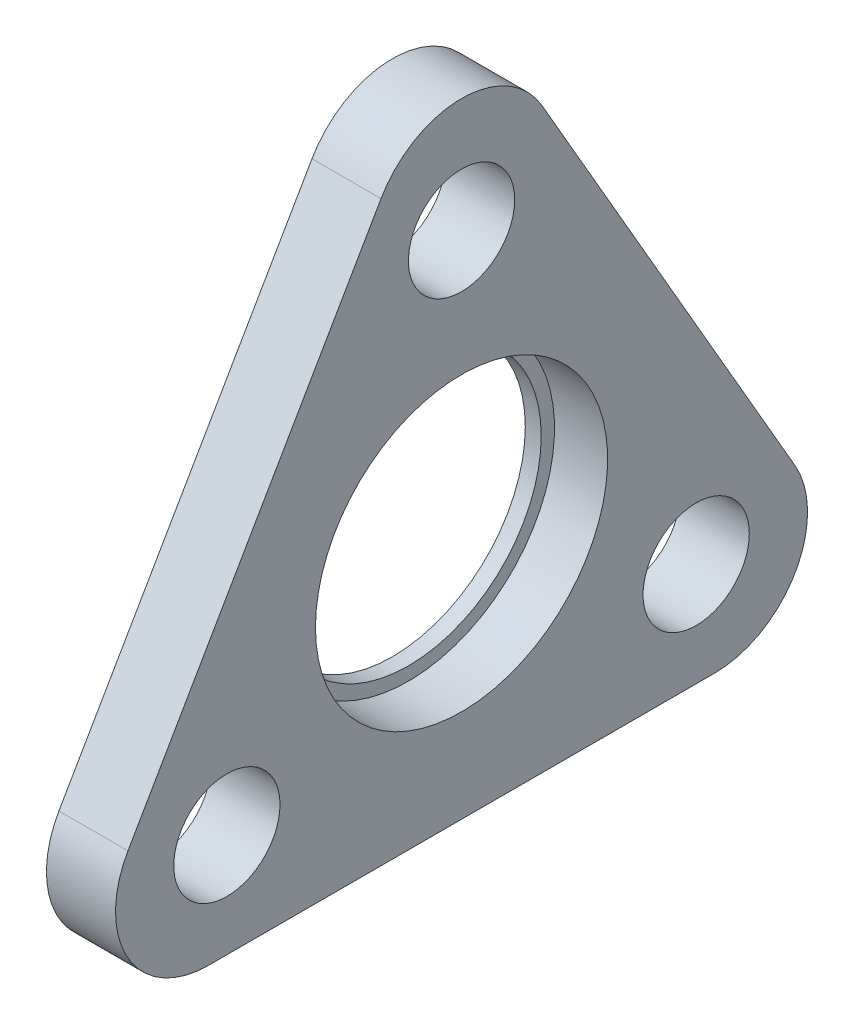
from build123d import *

# Parameters (mm, degrees)
SKETCH_1_R          = 2
EXTRUDE_2_DEPTH     = 2.6
FILLET_1_R          = 3.5
SKETCH_4_R          = 5.5
CUT_EXTRUDE_1_DEPTH = 20.664535491
SKETCH_6_R          = 5.5
SKETCH_6_R_2        = 5
EXTRUDE_4_DEPTH     = 0.6


with BuildPart() as part:
    # 草图1 → 凸台-拉伸2 (new body)
    with BuildSketch(Plane(origin=(0, 0, 0), x_dir=(0, 0, -1), z_dir=(1, 0, 0))):
        Polygon((0, 18), (-15.588457268, -9), (15.588457268, -9), align=None)
        with Locations((0, 10.2)):
            Circle(SKETCH_1_R, mode=Mode.SUBTRACT)
        with Locations((8.833459119, -5.1)):
            Circle(SKETCH_1_R, mode=Mode.SUBTRACT)
        with Locations((-8.833459119, -5.1)):
            Circle(SKETCH_1_R, mode=Mode.SUBTRACT)
    extrude(amount=EXTRUDE_2_DEPTH)

    # 圆角1
    fillet_1_edges = [part.edges().sort_by_distance(p)[0] for p in [
        (1.3, 18, 0),
        (1.3, -9, -15.588457268),
        (1.3, -9, 15.588457268),
    ]]
    fillet(fillet_1_edges, radius=FILLET_1_R)

    # 草图4 → 切除-拉伸1 (cut, through all)
    with BuildSketch(Plane.ZY):
        Circle(SKETCH_4_R)
    extrude(amount=-CUT_EXTRUDE_1_DEPTH, mode=Mode.SUBTRACT)


with BuildPart() as body_2:
    # 草图6 → 凸台-拉伸4 (new body)
    with BuildSketch(Plane.ZY):
        Circle(SKETCH_6_R)
        Circle(SKETCH_6_R_2, mode=Mode.SUBTRACT)
    extrude(amount=-EXTRUDE_4_DEPTH)


solid = Compound([part.part, body_2.part])
